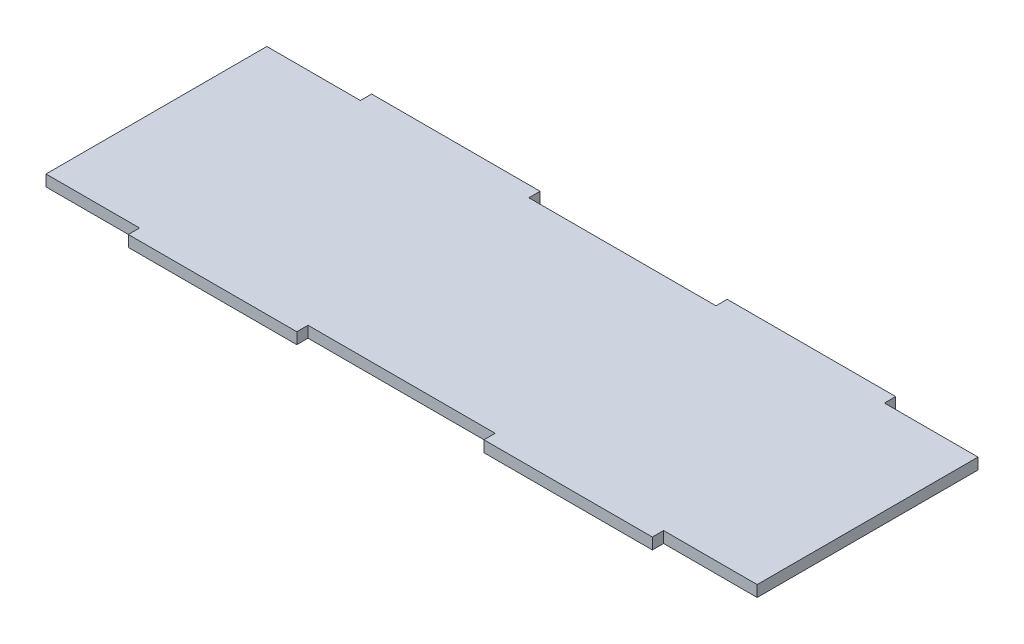
from build123d import *

# Parameters (mm, degrees)
SKETCH1_W               = 190
SKETCH1_H               = 65
BOSS_EXTRUDE1_DEPTH     = 3
CUT_EXTRUDE1_DEPTH      = 101.450236436
CUT_EXTRUDE1_DEPTH_BACK = 3
SKETCH2_OUTSIDE_W       = 232.166
SKETCH2_OUTSIDE_H       = 107.166


with BuildPart() as part:
    # Sketch1 → Boss-Extrude1 (new body)
    with BuildSketch(Plane(origin=(0, 0, 0), x_dir=(1, 0, 0), z_dir=(0, 1, 0))):
        Rectangle(SKETCH1_W, SKETCH1_H)
    extrude(amount=BOSS_EXTRUDE1_DEPTH)

    # Sketch2 outside → Cut-Extrude1 (cut, two sides: drawn at the far end of the back side and taken through both)
    with BuildSketch(Plane(origin=(0, 3, 0), x_dir=(1, 0, 0), z_dir=(0, 1, 0)).offset(-CUT_EXTRUDE1_DEPTH_BACK)):
        Rectangle(SKETCH2_OUTSIDE_W, SKETCH2_OUTSIDE_H)
        Polygon((-95, 29.5), (-70, 29.5), (-70, 32.5), (-25, 32.5), (-25, 29.5), (25, 29.5), (25, 32.5), (70, 32.5), (70, 29.5), (95, 29.5), (95, -29.5), (70, -29.5), (70, -32.5), (25, -32.5), (25, -29.5), (-25, -29.5), (-25, -32.5), (-70, -32.5), (-70, -29.5), (-95, -29.5), align=None, mode=Mode.SUBTRACT)
    extrude(amount=CUT_EXTRUDE1_DEPTH + CUT_EXTRUDE1_DEPTH_BACK, mode=Mode.SUBTRACT)


solid = part.part
